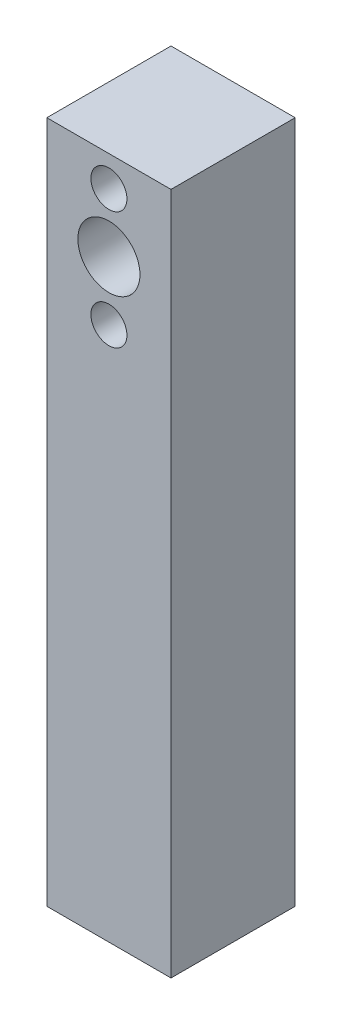
from build123d import *

# Parameters (mm, degrees)
SKETCH1_W           = 12.7
SKETCH1_H           = 69.85
BOSS_EXTRUDE1_DEPTH = 12.7
SKETCH2_R           = 3.175
SKETCH2_R_2         = 1.8415
CUT_EXTRUDE1_DEPTH  = 73.122135992


with BuildPart() as part:
    # Sketch1 → Boss-Extrude1 (new body)
    with BuildSketch(Plane.XY):
        with Locations((6.35, 34.925)):
            Rectangle(SKETCH1_W, SKETCH1_H)
    extrude(amount=BOSS_EXTRUDE1_DEPTH)

    # Sketch2 → Cut-Extrude1 (cut, through all)
    with BuildSketch(Plane.XY.offset(12.7)):
        with Locations((6.35, 60.706)):
            Circle(SKETCH2_R)
        with Locations((6.35, 66.7385)):
            Circle(SKETCH2_R_2)
        with Locations((6.35, 54.6735)):
            Circle(SKETCH2_R_2)
    extrude(amount=-CUT_EXTRUDE1_DEPTH, mode=Mode.SUBTRACT)


solid = part.part
